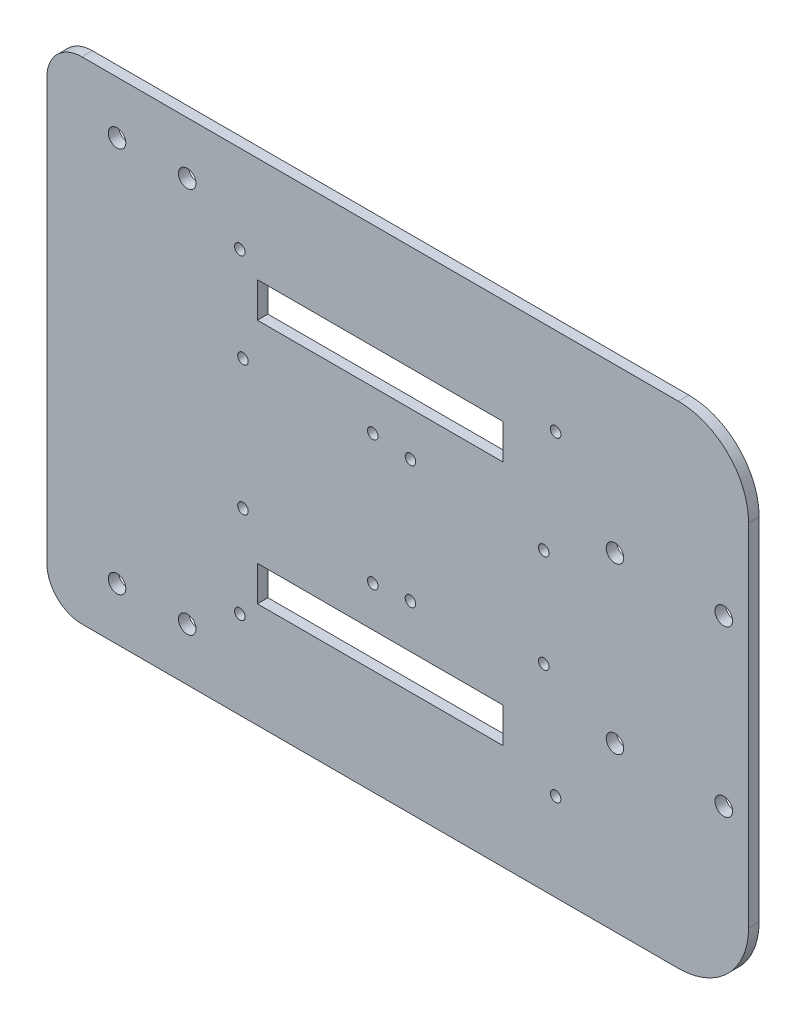
from build123d import *

# Parameters (mm, degrees)
SKETCH1_W           = 200
SKETCH1_H           = 140
BOSS_EXTRUDE1_DEPTH = 3
SKETCH2_R           = 1.5
SKETCH2_R_2         = 2.5
SKETCH2_W           = 70
SKETCH2_H           = 10
CUT_EXTRUDE1_DEPTH  = 3
FILLET1_R           = 10
FILLET2_R           = 20


with BuildPart() as part:
    # Sketch1 → Boss-Extrude1 (new body)
    with BuildSketch(Plane.XY):
        Rectangle(SKETCH1_W, SKETCH1_H)
    extrude(amount=BOSS_EXTRUDE1_DEPTH)

    # Sketch2 → Cut-Extrude1 (cut)
    with BuildSketch(Plane.XY.offset(3)):
        with Locations((3.621068531, -17.5)):
            Circle(SKETCH2_R)
        with Locations((41.621068531, 14)):
            Circle(SKETCH2_R)
        with Locations((-44.111928007, 18.5)):
            Circle(SKETCH2_R)
        with Locations((-7.111928007, 18.5)):
            Circle(SKETCH2_R)
        with Locations((-7.111928007, -18.5)):
            Circle(SKETCH2_R)
        with Locations((61.917005655, -23.5)):
            Circle(SKETCH2_R_2)
        with Locations((92.917005655, -23.5)):
            Circle(SKETCH2_R_2)
        with Locations((92.917005655, 23.5)):
            Circle(SKETCH2_R_2)
        with Locations((61.917005655, 23.5)):
            Circle(SKETCH2_R_2)
        with Locations((-60, 55)):
            Circle(SKETCH2_R_2)
        with Locations((-60, -55)):
            Circle(SKETCH2_R_2)
        with Locations((-80, -55)):
            Circle(SKETCH2_R_2)
        with BuildLine():
            ThreePointArc((46.5, 45), (45, 46.5), (43.5, 45))
            Line((43.5, 45), (45, 45))
            Line((45, 45), (45, 43.5))
            ThreePointArc((45, 43.5), (46.060660172, 43.939339828), (46.5, 45))
        make_face()
        with BuildLine():
            Line((45, 45), (43.5, 45))
            ThreePointArc((43.5, 45), (43.939339828, 43.939339828), (45, 43.5))
            Line((45, 43.5), (45, 45))
        make_face()
        with Locations((-5, 35)):
            Rectangle(SKETCH2_W, SKETCH2_H)
        with BuildLine():
            Line((-45, 43.5), (-45, 45))
            Line((-45, 45), (-43.5, 45))
            ThreePointArc((-43.5, 45), (-46.060660172, 46.060660172), (-45, 43.5))
        make_face()
        with BuildLine():
            Line((-43.5, 45), (-45, 45))
            Line((-45, 45), (-45, 43.5))
            ThreePointArc((-45, 43.5), (-43.939339828, 43.939339828), (-43.5, 45))
        make_face()
        with BuildLine():
            ThreePointArc((-42.611928007, -18.5), (-43.43447247, -17.161697346), (-45, -17.291145941))
            Line((-45, -17.291145941), (-45, -19.708854059))
            ThreePointArc((-45, -19.708854059), (-43.43447247, -19.838302654), (-42.611928007, -18.5))
        make_face()
        with BuildLine():
            Line((-45, -19.708854059), (-45, -17.291145941))
            ThreePointArc((-45, -17.291145941), (-45.611928007, -18.5), (-45, -19.708854059))
        make_face()
        with Locations((41.621068531, -14)):
            Circle(SKETCH2_R)
        with Locations((-80, 55)):
            Circle(SKETCH2_R_2)
        with Locations((-5, -35)):
            Rectangle(SKETCH2_W, SKETCH2_H)
        with Locations((45, -45)):
            Circle(SKETCH2_R)
        with Locations((-45, -45)):
            Circle(SKETCH2_R)
        with Locations((3.621068531, 17.5)):
            Circle(SKETCH2_R)
    extrude(amount=-CUT_EXTRUDE1_DEPTH, mode=Mode.SUBTRACT)

    # Fillet1
    fillet1_edges = [part.edges().sort_by_distance(p)[0] for p in [
        (-100, -70, 1.5),
        (-100, 70, 1.5),
    ]]
    fillet(fillet1_edges, radius=FILLET1_R)

    # Fillet2
    fillet2_edges = [part.edges().sort_by_distance(p)[0] for p in [
        (100, -70, 1.5),
        (100, 70, 1.5),
    ]]
    fillet(fillet2_edges, radius=FILLET2_R)


solid = part.part
